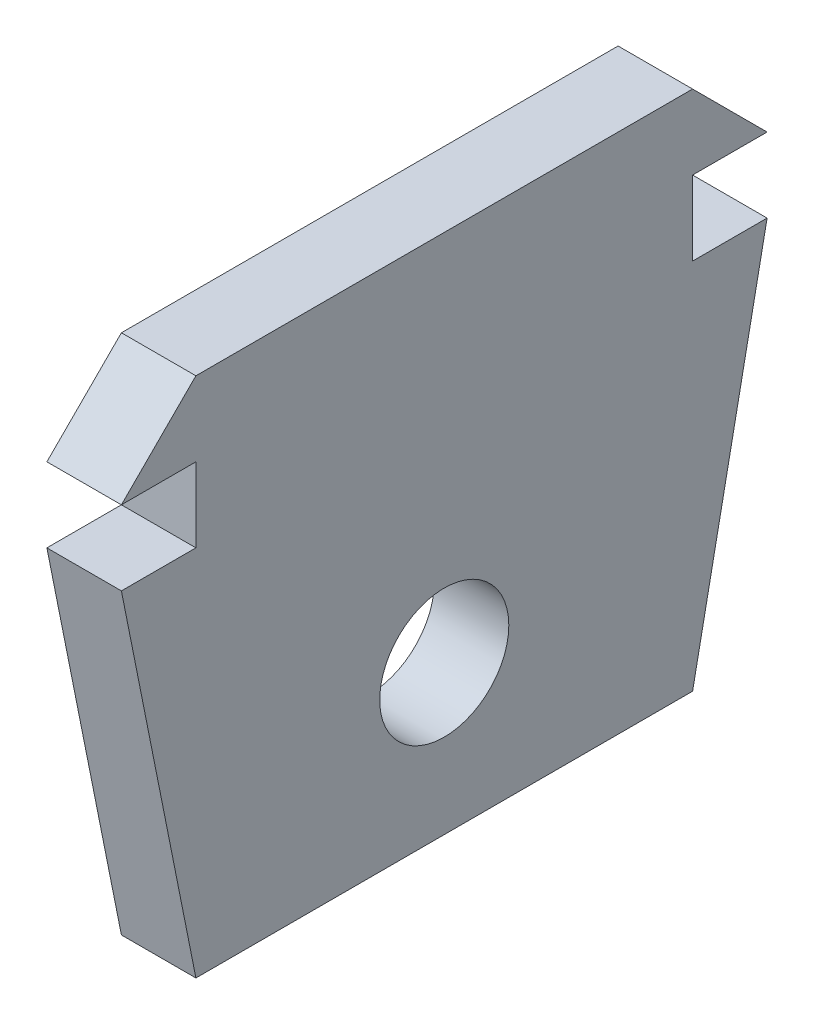
from build123d import *

# Parameters (mm, degrees)
ESQUISSE4_R        = 2.6
BOSS_EXTRU_2_DEPTH = 3


with BuildPart() as part:
    # Esquisse4 → Boss.-Extru.2 (new body)
    with BuildSketch(Plane(origin=(0, 0, 0), x_dir=(0, 0, -1), z_dir=(1, 0, 0))):
        Polygon((-20, 0), (0, 0), (3, 15), (0, 15), (0, 18), (3, 18), (0, 21), (-20, 21), (-23, 18), (-20, 18), (-20, 15), (-23, 15), align=None)
        with Locations((-10, 6)):
            Circle(ESQUISSE4_R, mode=Mode.SUBTRACT)
    extrude(amount=BOSS_EXTRU_2_DEPTH)


solid = part.part
